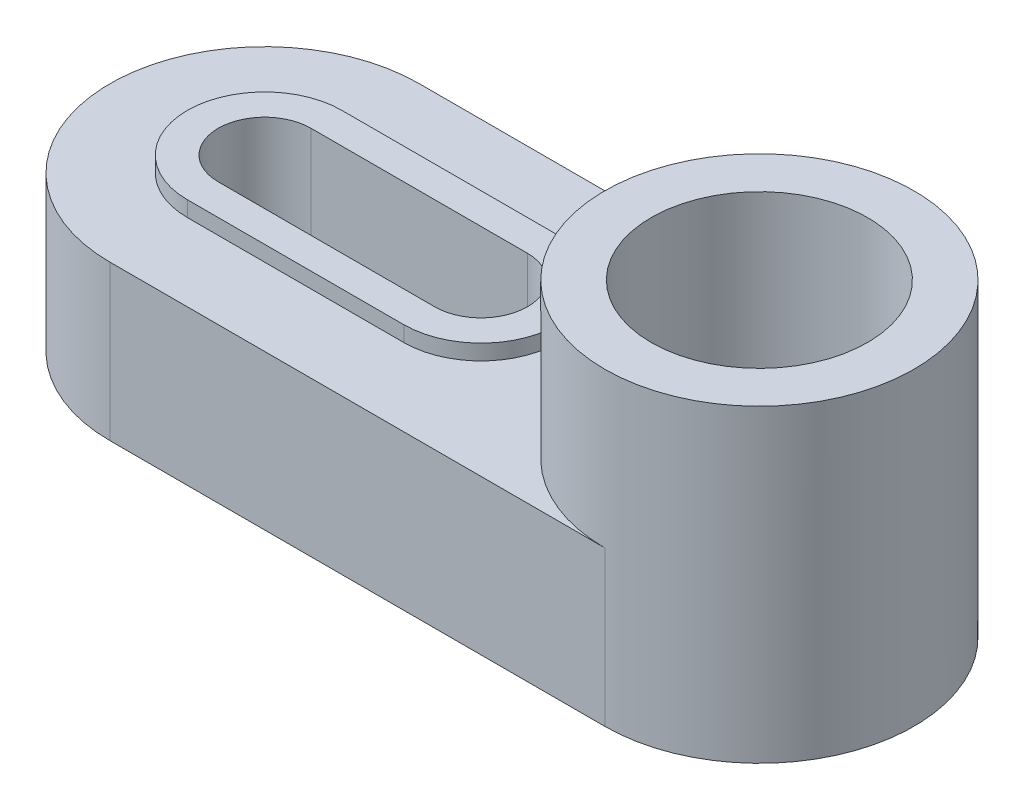
from build123d import *

# Parameters (mm, degrees)
EXTRUDE_1_DEPTH = 10
SKETCH_1_5_R    = 7
EXTRUDE_2_DEPTH = 20
EXTRUDE_3_DEPTH = 11


with BuildPart() as part:
    # 草图1 → 凸台-拉伸1 (new body)
    with BuildSketch(Plane(origin=(0, 0, 0), x_dir=(1, 0, 0), z_dir=(0, 1, 0))):
        with BuildLine():
            Line((25.09623431, 10), (-6.90376569, 10))
            ThreePointArc((-6.90376569, 10), (-16.90376569, 0), (-6.90376569, -10))
            Line((-6.90376569, -10), (25.09623431, -10))
            ThreePointArc((25.09623431, -10), (15.09623431, 0), (25.09623431, 10))
        make_face()
        with BuildLine():
            ThreePointArc((-6.90376569, -5), (-11.90376569, 0), (-6.90376569, 5))
            Line((-6.90376569, 5), (7.09623431, 5))
            ThreePointArc((7.09623431, 5), (12.09623431, 0), (7.09623431, -5))
            Line((7.09623431, -5), (-6.90376569, -5))
        make_face(mode=Mode.SUBTRACT)
    extrude(amount=EXTRUDE_1_DEPTH)

    # 草图1<5> → 凸台-拉伸2 (add)
    with BuildSketch(Plane(origin=(0, 0, 0), x_dir=(1, 0, 0), z_dir=(0, 1, 0))):
        with BuildLine():
            ThreePointArc((35.09623431, 0), (32.167302121, 7.071067812), (25.09623431, 10))
            ThreePointArc((25.09623431, 10), (15.09623431, 0), (25.09623431, -10))
            ThreePointArc((25.09623431, -10), (32.167302121, -7.071067812), (35.09623431, 0))
        make_face()
        with Locations((25.09623431, 0)):
            Circle(SKETCH_1_5_R, mode=Mode.SUBTRACT)
    extrude(amount=EXTRUDE_2_DEPTH)

    # 草图1<6> → 凸台-拉伸3 (add)
    with BuildSketch(Plane(origin=(0, 0, 0), x_dir=(1, 0, 0), z_dir=(0, 1, 0))):
        with BuildLine():
            Line((-6.90376569, 5), (7.09623431, 5))
            ThreePointArc((7.09623431, 5), (12.09623431, 0), (7.09623431, -5))
            Line((7.09623431, -5), (-6.90376569, -5))
            ThreePointArc((-6.90376569, -5), (-11.90376569, 0), (-6.90376569, 5))
        make_face()
        with BuildLine():
            Line((-6.90376569, 3), (7.09623431, 3))
            ThreePointArc((7.09623431, 3), (10.09623431, 0), (7.09623431, -3))
            Line((7.09623431, -3), (-6.90376569, -3))
            ThreePointArc((-6.90376569, -3), (-9.90376569, 0), (-6.90376569, 3))
        make_face(mode=Mode.SUBTRACT)
    extrude(amount=EXTRUDE_3_DEPTH)


solid = part.part
